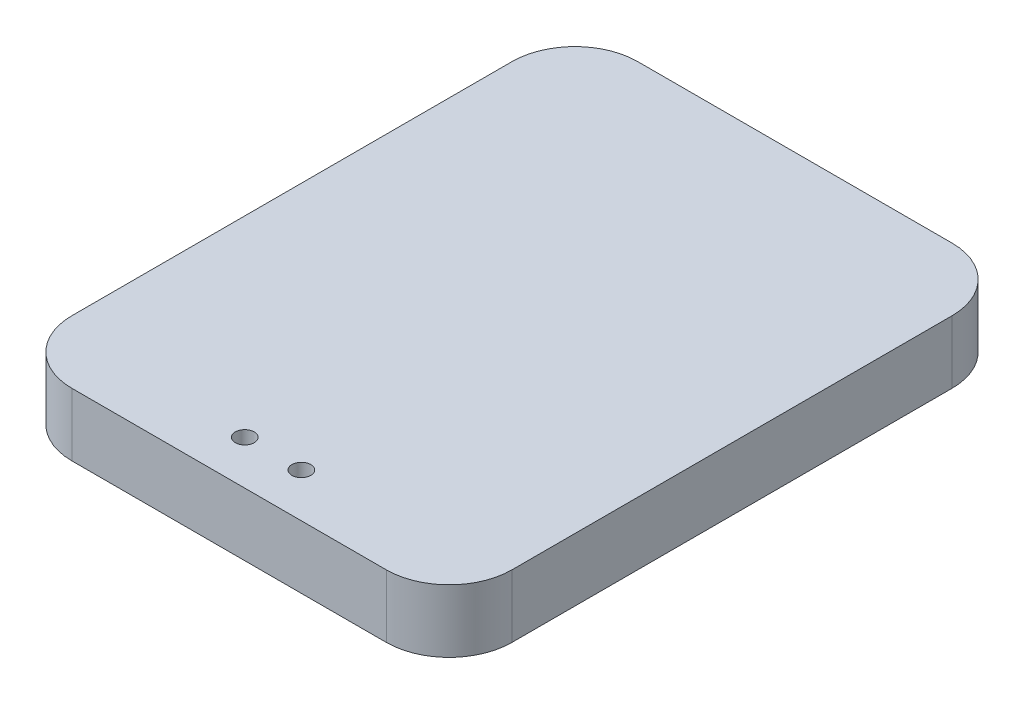
from build123d import *

# Parameters (mm, degrees)
SKETCH1_W           = 70
SKETCH1_H           = 90
BOSS_EXTRUDE1_DEPTH = 5
FILLET1_R           = 10
SKETCH2_R           = 1.5
CUT_EXTRUDE1_DEPTH  = 10


with BuildPart() as part:
    # Sketch1 → Boss-Extrude1 (new, symmetric)
    with BuildSketch(Plane(origin=(0, 0, 0), x_dir=(1, 0, 0), z_dir=(0, 1, 0))):
        Rectangle(SKETCH1_W, SKETCH1_H)
    extrude(amount=BOSS_EXTRUDE1_DEPTH, both=True)

    # Fillet1
    fillet1_edges = [part.edges().sort_by_distance(p)[0] for p in [
        (-35, 0, -45),
        (35, 0, -45),
        (35, 0, 45),
        (-35, 0, 45),
    ]]
    fillet(fillet1_edges, radius=FILLET1_R)

    # Sketch2 → Cut-Extrude1 (cut)
    with BuildSketch(Plane(origin=(0, 5, 0), x_dir=(1, 0, 0), z_dir=(0, 1, 0))):
        with Locations(Location((-4.5, -38, 0), (0, 0, 270))):
            Circle(SKETCH2_R)
        with Locations(Location((4.5, -38, 0), (0, 0, 270))):
            Circle(SKETCH2_R)
    extrude(amount=-CUT_EXTRUDE1_DEPTH, mode=Mode.SUBTRACT)


solid = part.part
